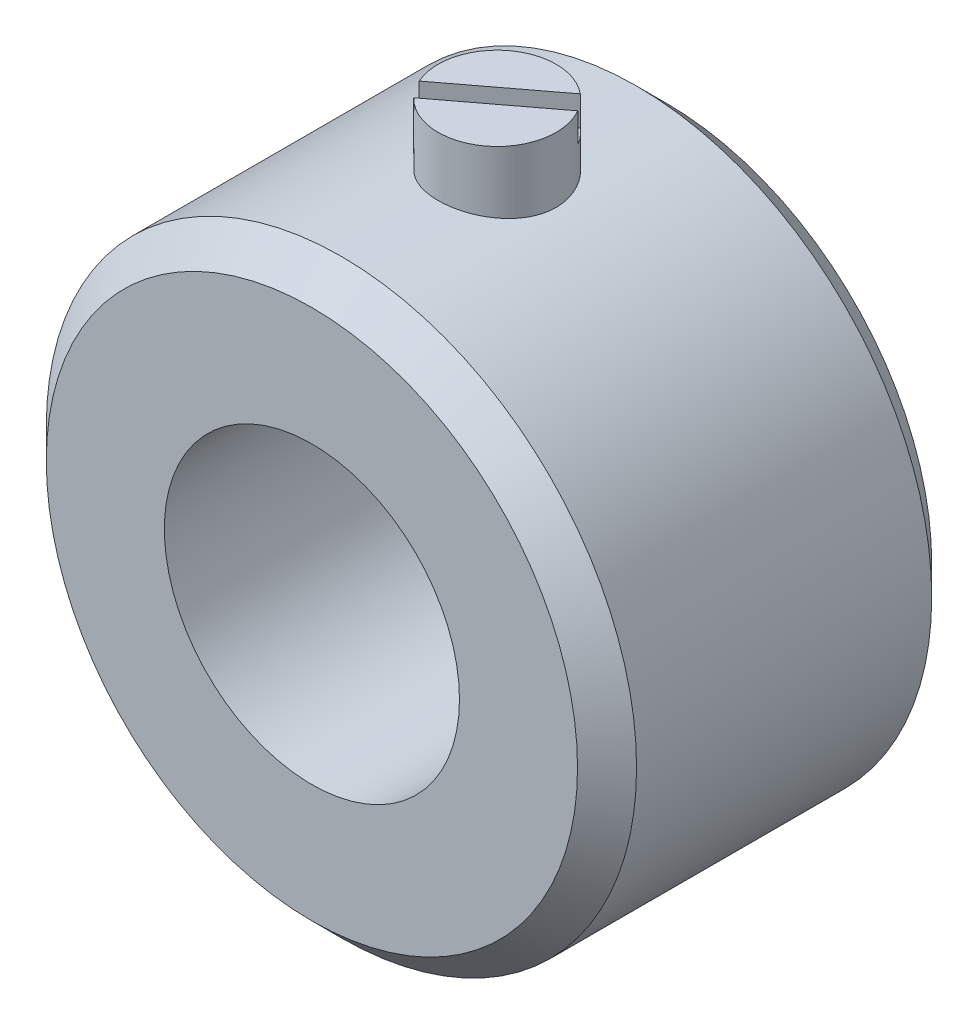
from build123d import *

# Parameters (mm, degrees)
SKETCH2_R           = 5
SKETCH2_R_2         = 2.5
BOSS_EXTRUDE1_DEPTH = 6
CHAMFER1_SIZE       = 0.5
SKETCH4_R           = 1
BOSS_EXTRUDE2_DEPTH = 2
CUT_EXTRUDE2_DEPTH  = 0.5
CHAMFER2_SIZE       = 0.5


with BuildPart() as part:
    # Sketch2 → Boss-Extrude1 (new body)
    with BuildSketch(Plane.XY):
        Circle(SKETCH2_R)
        Circle(SKETCH2_R_2, mode=Mode.SUBTRACT)
    extrude(amount=BOSS_EXTRUDE1_DEPTH)

    # Chamfer1
    chamfer1_edges = [part.edges().sort_by_distance(p)[0] for p in [
        (-5, 0, 6),
    ]]
    chamfer(chamfer1_edges, length=CHAMFER1_SIZE)

    # Sketch4 → Boss-Extrude2 (add)
    with BuildSketch(Plane(origin=(0, 4, 0), x_dir=(1, 0, 0), z_dir=(0, 1, 0))):
        with Locations(Location((0, -2.861781198, 0), (0, 0, 90))):
            Circle(SKETCH4_R)
    extrude(amount=BOSS_EXTRUDE2_DEPTH)

    # Sketch5 → Cut-Extrude2 (cut)
    with BuildSketch(Plane(origin=(0, 6, 0), x_dir=(1, 0, 0), z_dir=(0, 1, 0))):
        Polygon((-1.135229539, -3.436253086), (0.891979559, -1.900488617), (1.105020903, -2.181703191), (-0.922188195, -3.71746766), align=None)
    extrude(amount=-CUT_EXTRUDE2_DEPTH, mode=Mode.SUBTRACT)

    # Chamfer2
    chamfer2_edges = [part.edges().sort_by_distance(p)[0] for p in [
        (-5, 0, 0),
    ]]
    chamfer(chamfer2_edges, length=CHAMFER2_SIZE)


solid = part.part
